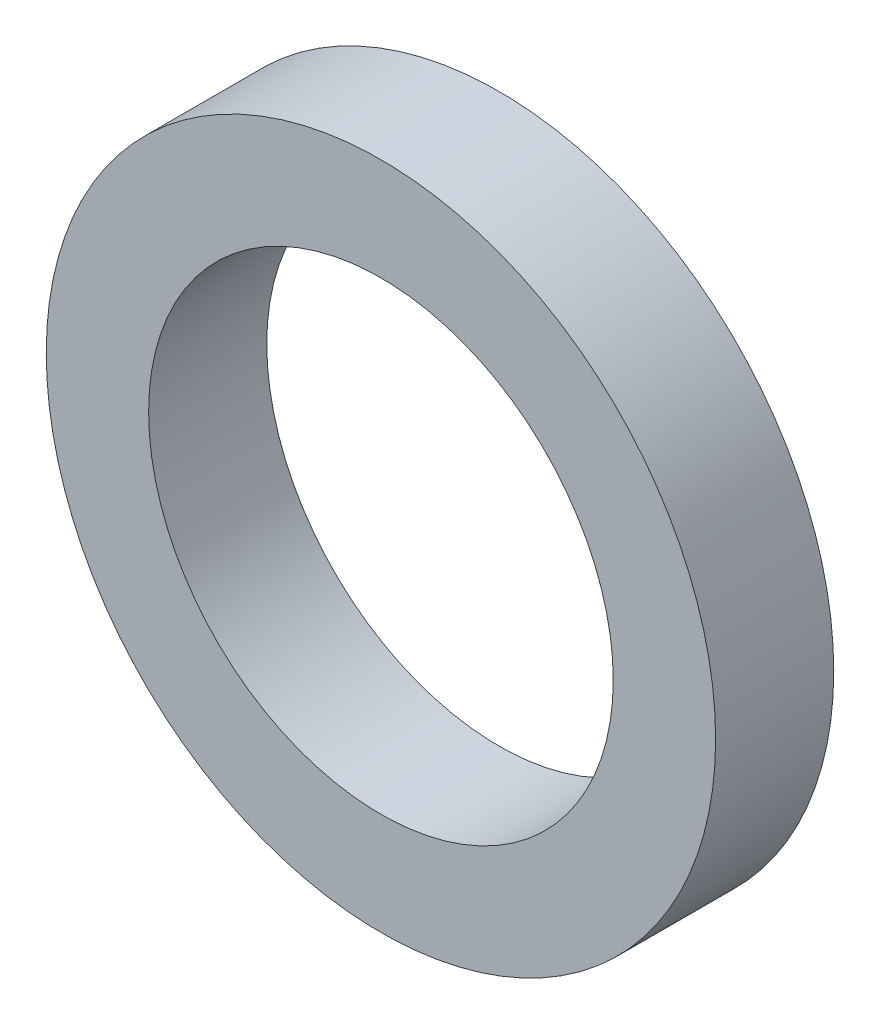
from build123d import *

# Parameters (mm, degrees)
SKETCH1_R           = 42.5
SKETCH1_R_2         = 29.5
BOSS_EXTRUDE1_DEPTH = 15


with BuildPart() as part:
    # Sketch1 → Boss-Extrude1 (new body)
    with BuildSketch(Plane.XY):
        Circle(SKETCH1_R)
        Circle(SKETCH1_R_2, mode=Mode.SUBTRACT)
    extrude(amount=-BOSS_EXTRUDE1_DEPTH)


solid = part.part
